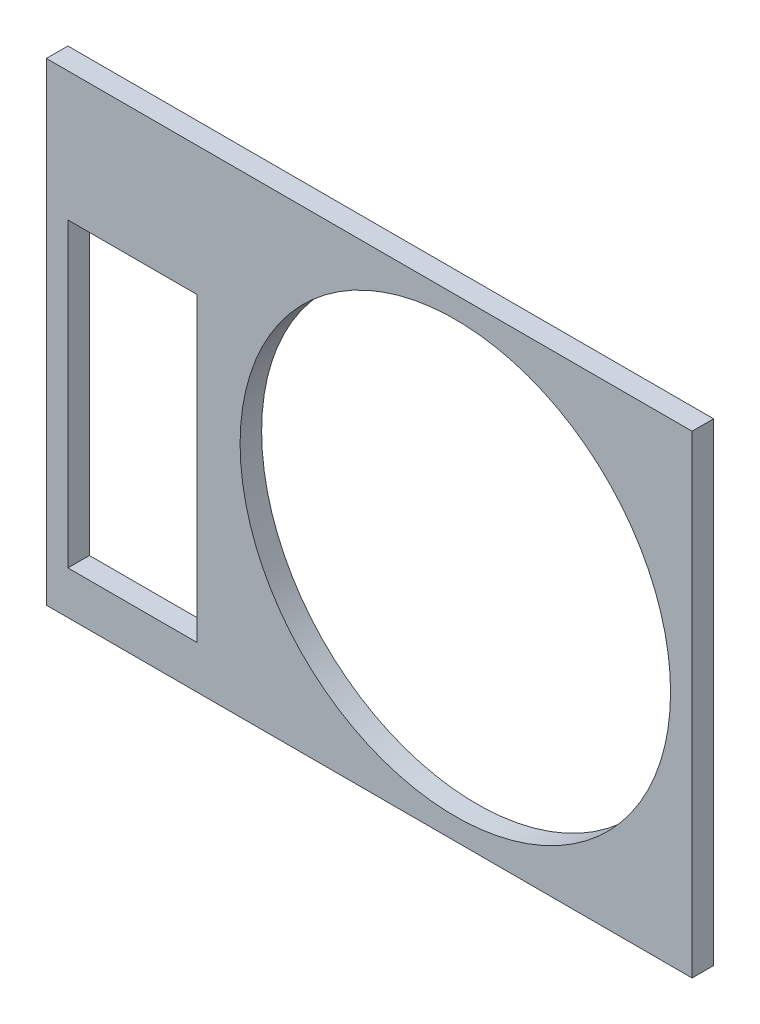
from build123d import *

# Parameters (mm, degrees)
CROQUIS1_W              = 300
CROQUIS1_H              = 220
CROQUIS1_R              = 100
SALIENTE_EXTRUIR1_DEPTH = 10
CROQUIS2_W              = 60
CROQUIS2_H              = 140
CORTAR_EXTRUIR1_DEPTH   = 10


with BuildPart() as part:
    # Croquis1 → Saliente-Extruir1 (new body)
    with BuildSketch(Plane.XY):
        with Locations((150, 110)):
            Rectangle(CROQUIS1_W, CROQUIS1_H)
        with Locations((190, 110)):
            Circle(CROQUIS1_R, mode=Mode.SUBTRACT)
    extrude(amount=SALIENTE_EXTRUIR1_DEPTH)

    # Croquis2 → Cortar-Extruir1 (cut)
    with BuildSketch(Plane.XY.offset(10)):
        with Locations((40, 90)):
            Rectangle(CROQUIS2_W, CROQUIS2_H)
    extrude(amount=-CORTAR_EXTRUIR1_DEPTH, mode=Mode.SUBTRACT)


solid = part.part
